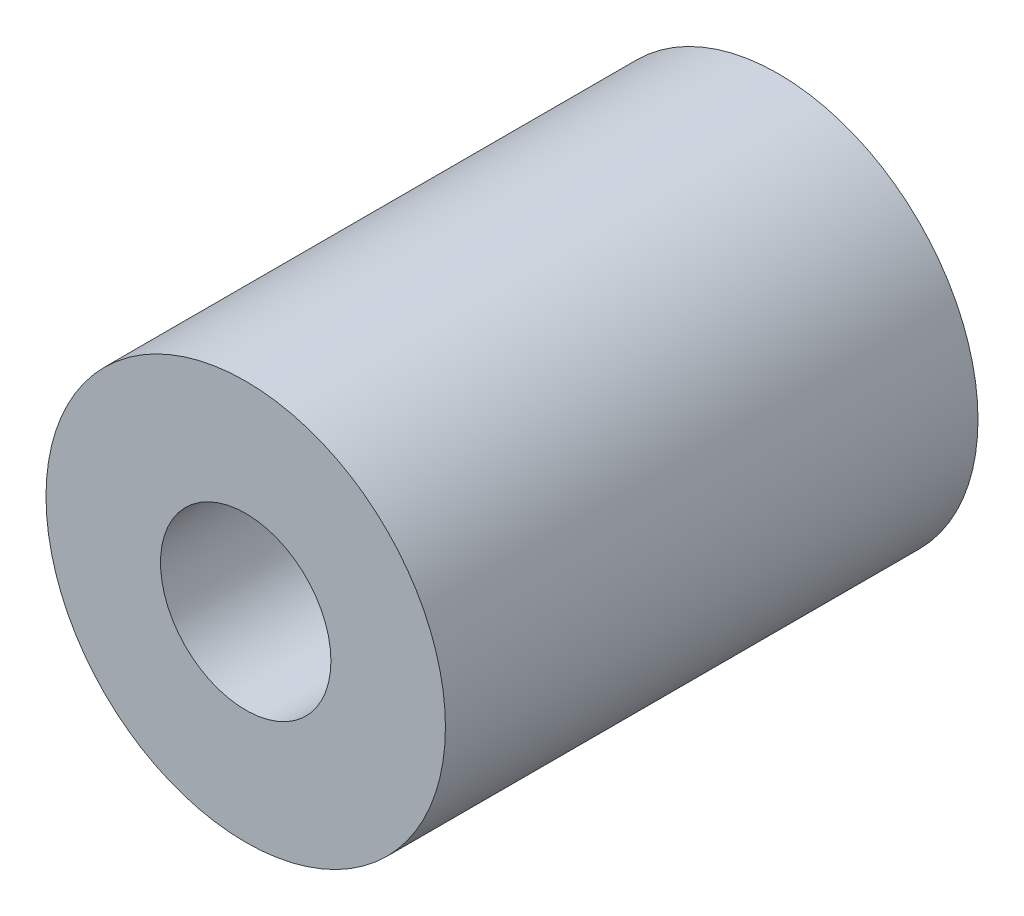
from build123d import *

# Parameters (mm, degrees)
SKETCH_1_R      = 7.5
SKETCH_1_R_2    = 3.2
EXTRUDE_1_DEPTH = 20


with BuildPart() as part:
    # 스케치1 → 보스-돌출1 (new body)
    with BuildSketch(Plane.XY):
        Circle(SKETCH_1_R)
        Circle(SKETCH_1_R_2, mode=Mode.SUBTRACT)
    extrude(amount=EXTRUDE_1_DEPTH)


solid = part.part
